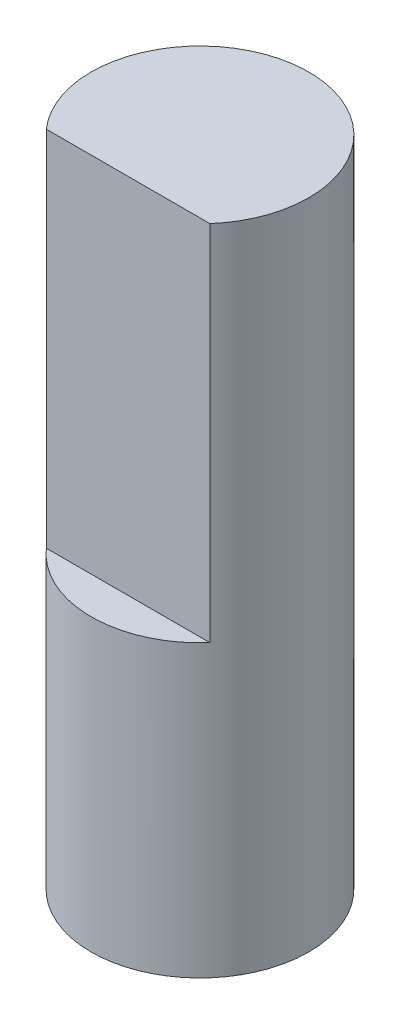
from build123d import *

# Parameters (mm, degrees)
SKETCH1_R           = 1.5
BOSS_EXTRUDE1_DEPTH = 9
CUT_EXTRUDE1_START  = -5
CUT_EXTRUDE1_DEPTH  = 5


with BuildPart() as part:
    # Sketch1 → Boss-Extrude1 (new body)
    with BuildSketch(Plane(origin=(0, 0, 0), x_dir=(1, 0, 0), z_dir=(0, 1, 0))):
        with Locations(Location((0, 0, 0), (0, 0, 270))):
            Circle(SKETCH1_R)
    extrude(amount=BOSS_EXTRUDE1_DEPTH)

    # Sketch2 → Cut-Extrude1 (cut)
    with BuildSketch(Plane(origin=(0, 9, 0), x_dir=(1, 0, 0), z_dir=(0, 1, 0)).offset(CUT_EXTRUDE1_START)):
        with BuildLine():
            Line((-1.126421796, -0.990542244), (1.126421796, -0.990542244))
            ThreePointArc((1.126421796, -0.990542244), (0, -1.5), (-1.126421796, -0.990542244))
        make_face()
    extrude(amount=CUT_EXTRUDE1_DEPTH, mode=Mode.SUBTRACT)


solid = part.part
